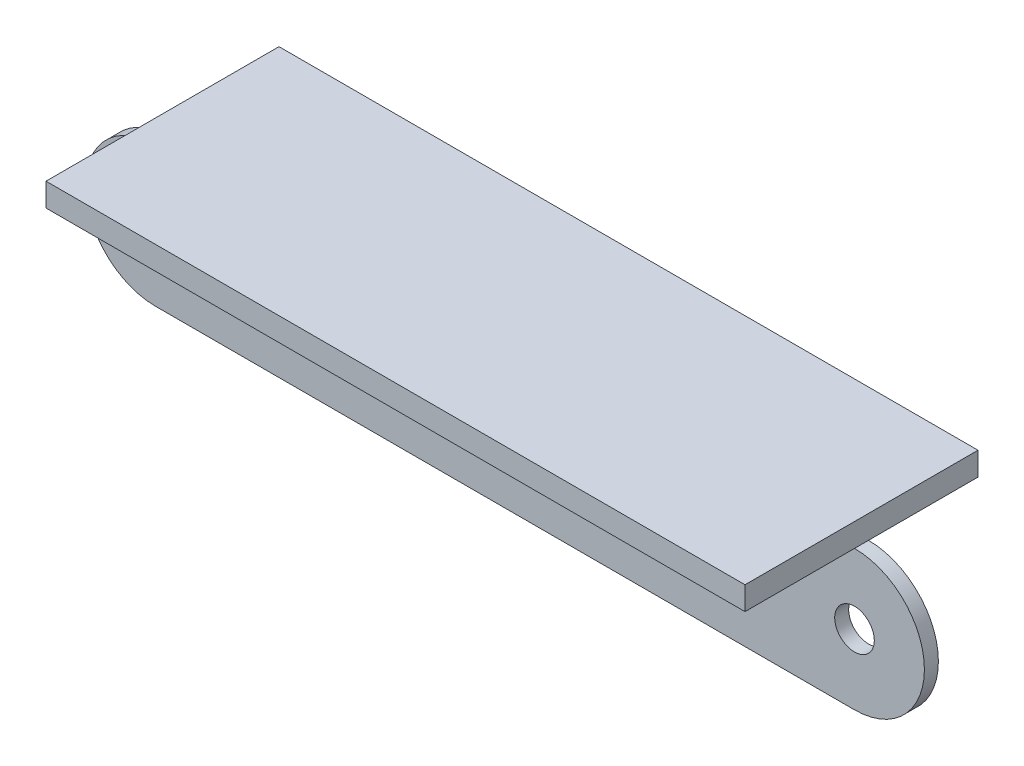
from build123d import *

# Parameters (mm, degrees)
ESBO_O1_R                = 4.25
RESSALTO_EXTRUS_O1_DEPTH = 3
ESBO_O2_W                = 150
ESBO_O2_H                = 50
RESSALTO_EXTRUS_O2_DEPTH = 5
RESSALTO_EXTRUS_O3_START = -25
RESSALTO_EXTRUS_O3_DEPTH = 100


with BuildPart() as part:
    # Esboço1 → Ressalto-extrusão1 (new body)
    with BuildSketch(Plane.XY):
        with BuildLine():
            Line((-85.207100592, 26.183431953), (64.792899408, 26.183431953))
            ThreePointArc((64.792899408, 26.183431953), (79.792899408, 11.183431953), (64.792899408, -3.816568047))
            Line((64.792899408, -3.816568047), (-85.207100592, -3.816568047))
            ThreePointArc((-85.207100592, -3.816568047), (-100.207100592, 11.183431953), (-85.207100592, 26.183431953))
        make_face()
        with Locations((-85.207100592, 11.183431953)):
            Circle(ESBO_O1_R, mode=Mode.SUBTRACT)
        with Locations((64.792899408, 11.183431953)):
            Circle(ESBO_O1_R, mode=Mode.SUBTRACT)
    extrude(amount=RESSALTO_EXTRUS_O1_DEPTH)

    # Esboço2 → Ressalto-extrusão2 (add)
    with BuildSketch(Plane(origin=(0, 26.183431953, 0), x_dir=(1, 0, 0), z_dir=(0, 1, 0))):
        with Locations((-10.207100592, -1.5)):
            Rectangle(ESBO_O2_W, ESBO_O2_H)
    extrude(amount=RESSALTO_EXTRUS_O2_DEPTH)

    # Esboço3 → Ressalto-extrusão3 (add)
    with BuildSketch(Plane.ZY.offset(85.207100592).offset(RESSALTO_EXTRUS_O3_START)):
        Polygon((3, 19.683431953), (9.5, 26.183431953), (3, 26.183431953), align=None)
        Polygon((0, 26.183431953), (0, 19.683431953), (-6.5, 26.183431953), align=None)
    extrude(amount=-RESSALTO_EXTRUS_O3_DEPTH)


solid = part.part
